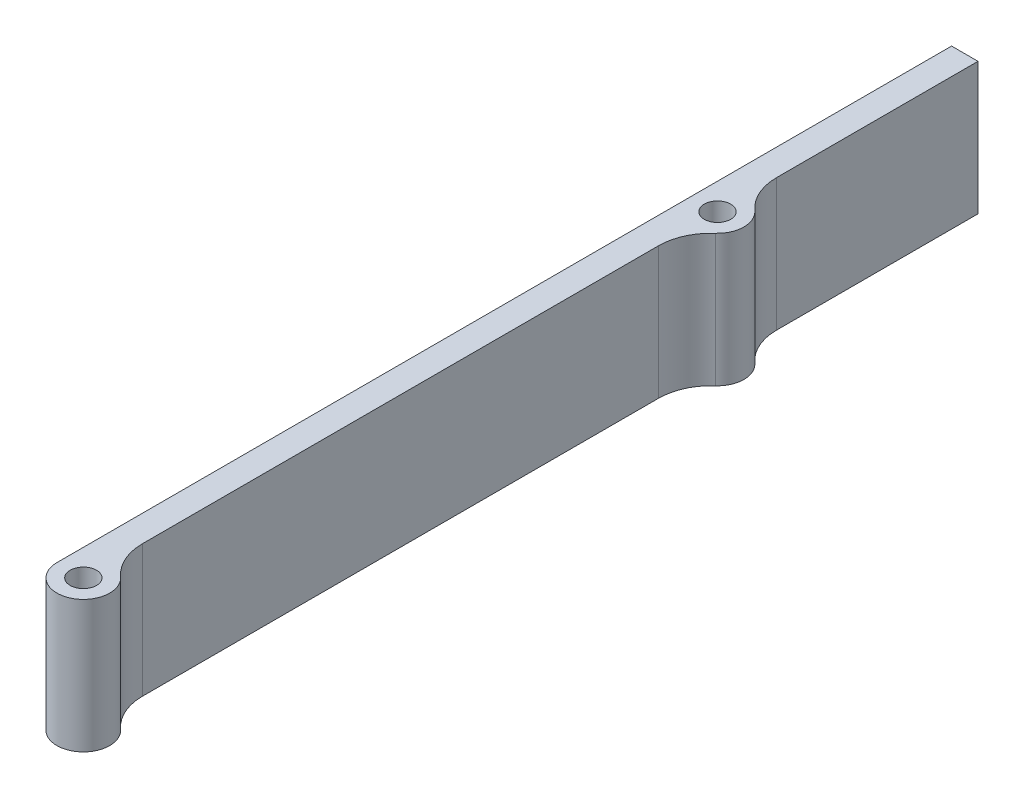
from build123d import *

# Parameters (mm, degrees)
SKETCH2_R           = 2.5
BOSS_EXTRUDE1_DEPTH = 25
SKETCH3_R           = 1
CUT_EXTRUDE1_DEPTH  = 25


with BuildPart() as part:
    # Sketch2 → Boss-Extrude1 (new body)
    with BuildSketch(Plane(origin=(0, 0, 0), x_dir=(1, 0, 0), z_dir=(0, 1, 0))):
        with BuildLine():
            Line((0, 33.847554993), (0, -135.452445007))
            ThreePointArc((0, -135.452445007), (7.041241452, -140.016799653), (8.333333333, -131.725665044))
            ThreePointArc((8.333333333, -131.725665044), (5.871290708, -128.354588024), (5, -124.272105119))
            Line((5, -124.272105119), (5, -26.632784894))
            ThreePointArc((5, -26.632784894), (5.871290708, -22.55030199), (8.333333333, -19.179224969))
            ThreePointArc((8.333333333, -19.179224969), (10, -15.452445007), (8.333333333, -11.725665044))
            ThreePointArc((8.333333333, -11.725665044), (5.871290708, -8.354588024), (5, -4.272105119))
            Line((5, -4.272105119), (5, 33.847554993))
            Line((5, 33.847554993), (0, 33.847554993))
        make_face()
        with Locations(Location((5, -15.452445007, 0), (0, 0, 270))):
            Circle(SKETCH2_R, mode=Mode.SUBTRACT)
        with Locations(Location((5, -135.452445007, 0), (0, 0, 270))):
            Circle(SKETCH2_R, mode=Mode.SUBTRACT)
    extrude(amount=BOSS_EXTRUDE1_DEPTH)

    # Sketch3 → Cut-Extrude1 (cut)
    with BuildSketch(Plane(origin=(0, 0, -33.847554993), x_dir=(-1, 0, 0), z_dir=(0, 0, -1))):
        with Locations((-2.5, 10)):
            Circle(SKETCH3_R)
        with Locations((-2.5, 20)):
            Circle(SKETCH3_R)
    extrude(amount=-CUT_EXTRUDE1_DEPTH, mode=Mode.SUBTRACT)


solid = part.part
